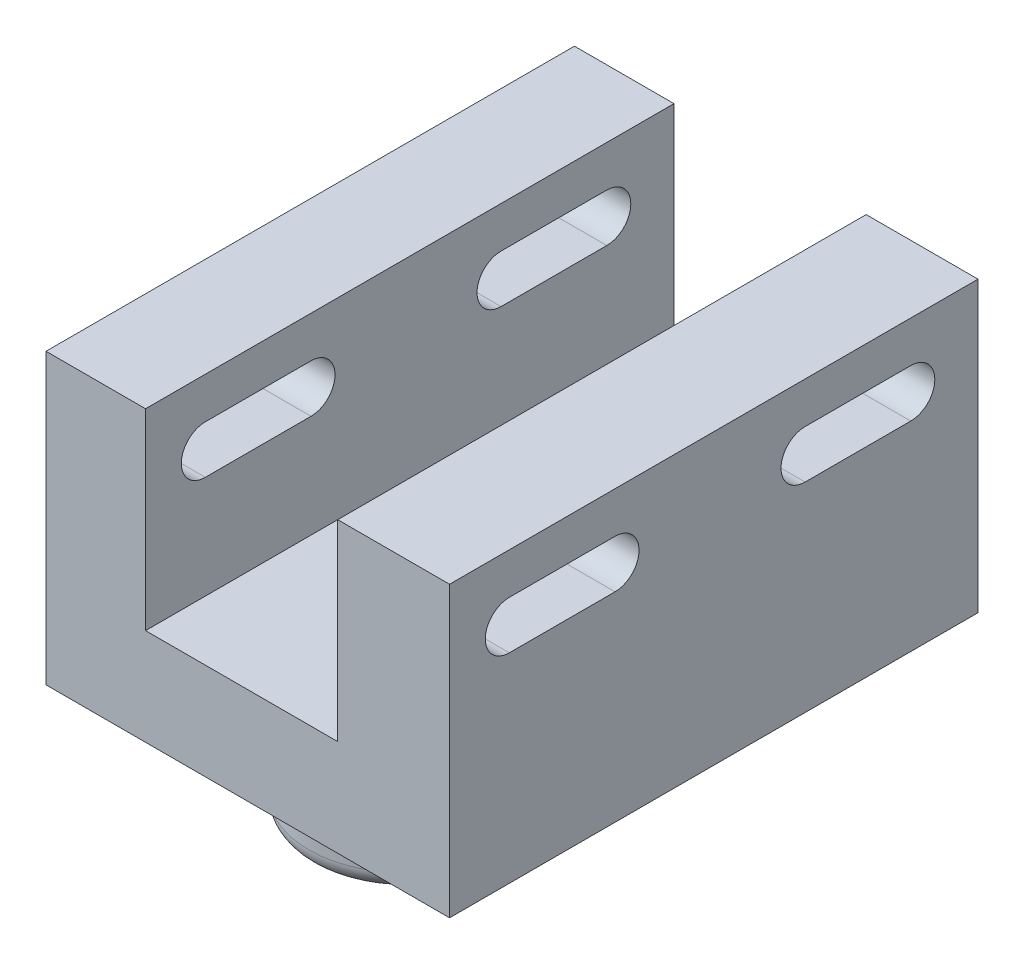
from build123d import *

# Parameters (mm, degrees)
BOSS_EXTRUDE1_DEPTH = 6.35
BOSS_EXTRUDE2_DEPTH = 6.604
SKETCH3_W           = 53.34
SKETCH3_H           = 69.85
BOSS_EXTRUDE3_DEPTH = 38.185673152
FILLET1_R           = 2.54
SKETCH4_W           = 25.4
SKETCH4_H           = 25.4
CUT_EXTRUDE1_DEPTH  = 70.358
CUT_EXTRUDE2_DEPTH  = 89.255701154


with BuildPart() as part:
    # Sketch1 → Boss-Extrude1 (new body)
    with BuildSketch(Plane(origin=(0, 0, 0), x_dir=(1, 0, 0), z_dir=(0, 1, 0))):
        with BuildLine():
            Line((-12.7, 0), (-12.7, 25.4))
            ThreePointArc((-12.7, 25.4), (0, 38.1), (12.7, 25.4))
            Line((12.7, 25.4), (12.7, 0))
            ThreePointArc((12.7, 0), (0, -12.7), (-12.7, 0))
        make_face()
    extrude(amount=BOSS_EXTRUDE1_DEPTH)

    # Sketch2 → Boss-Extrude2 (add)
    with BuildSketch(Plane(origin=(0, 6.35, 0), x_dir=(1, 0, 0), z_dir=(0, 1, 0))):
        with BuildLine():
            Line((-6.35, 0), (-6.35, 25.4))
            ThreePointArc((-6.35, 25.4), (0, 31.75), (6.35, 25.4))
            Line((6.35, 25.4), (6.35, 0))
            ThreePointArc((6.35, 0), (0, -6.35), (-6.35, 0))
        make_face()
    extrude(amount=BOSS_EXTRUDE2_DEPTH)

    # Sketch3 → Boss-Extrude3 (add)
    with BuildSketch(Plane(origin=(0, 12.954, 0), x_dir=(1, 0, 0), z_dir=(0, 1, 0))):
        with Locations((0.81256739, 13.33105678)):
            Rectangle(SKETCH3_W, SKETCH3_H)
    extrude(amount=BOSS_EXTRUDE3_DEPTH)

    # Fillet1
    fillet1_edges = [part.edges().sort_by_distance(p)[0] for p in [
        (-12.7, 0, -12.7),
        (0, 0, -38.1),
        (12.7, 0, -12.7),
        (0, 0, 12.7),
    ]]
    fillet(fillet1_edges, radius=FILLET1_R)

    # Sketch4 → Cut-Extrude1 (cut)
    with BuildSketch(Plane(origin=(0, 0, -48.25605678), x_dir=(-1, 0, 0), z_dir=(0, 0, -1))):
        with Locations((0, 38.439673152)):
            Rectangle(SKETCH4_W, SKETCH4_H)
    extrude(amount=-CUT_EXTRUDE1_DEPTH, mode=Mode.SUBTRACT)

    # Sketch5 → Cut-Extrude2 (cut, through all)
    with BuildSketch(Plane(origin=(27.48256739, 0, 0), x_dir=(0, 0, -1), z_dir=(1, 0, 0))):
        with BuildLine():
            Line((0.277921972, 39.339563333), (-13.692078028, 39.339563333))
            ThreePointArc((-13.692078028, 39.339563333), (-16.867078028, 42.514563333), (-13.692078028, 45.689563333))
            Line((-13.692078028, 45.689563333), (0.277921972, 45.689563333))
            ThreePointArc((0.277921972, 45.689563333), (3.452921972, 42.514563333), (0.277921972, 39.339563333))
        make_face()
        with BuildLine():
            Line((25.4, 45.689563333), (39.37, 45.689563333))
            ThreePointArc((39.37, 45.689563333), (42.545, 42.514563333), (39.37, 39.339563333))
            Line((39.37, 39.339563333), (25.4, 39.339563333))
            ThreePointArc((25.4, 39.339563333), (22.225, 42.514563333), (25.4, 45.689563333))
        make_face()
    extrude(amount=-CUT_EXTRUDE2_DEPTH, mode=Mode.SUBTRACT)


solid = part.part
